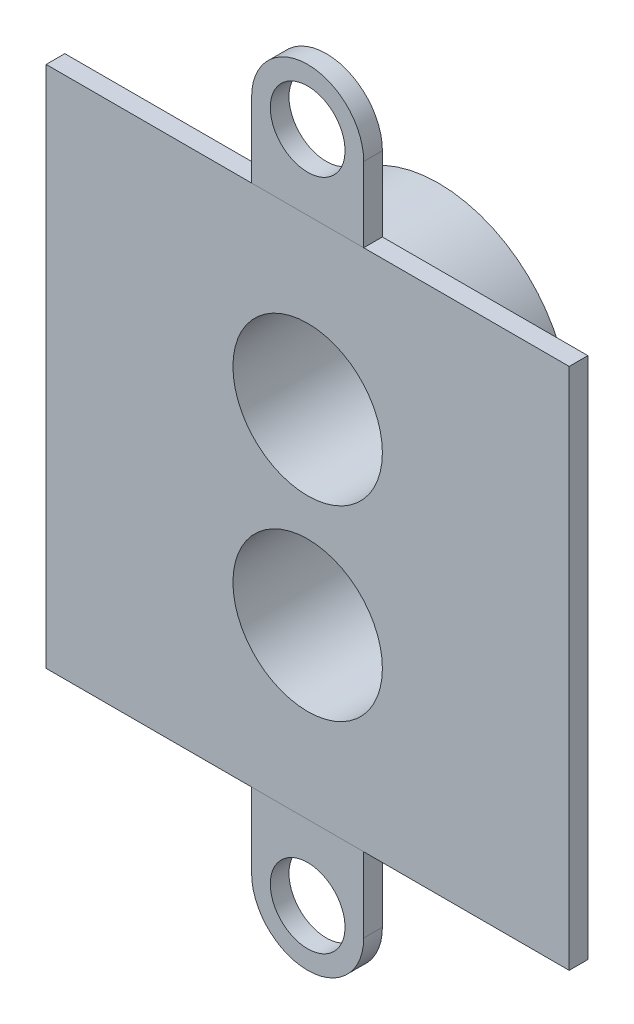
from build123d import *
from build123d.topology import SkipClean

# Parameters (mm, degrees)
SKETCH_2_W          = 14
SKETCH_2_H          = 14
SKETCH_2_R          = 2
EXTRUDE_1_DEPTH     = 0.5
SKETCH_3_W          = 3
SKETCH_3_H          = 0.5
EXTRUDE_2_DEPTH     = 3.5
CUT_EXTRUDE_1_DEPTH = 4
SKETCH_5_R          = 1
CUT_EXTRUDE_2_DEPTH = 4
EXTRUDE_START       = 3
SKETCH_8_R          = 2
EXTRUDE_4_DEPTH     = 3


with BuildPart() as part:
    # 草图2 → 凸台-拉伸1 (new body)
    with BuildSketch(Plane.XY):
        Rectangle(SKETCH_2_W, SKETCH_2_H)
        with Locations((0, -2.5)):
            Circle(SKETCH_2_R, mode=Mode.SUBTRACT)
        with Locations((0, 2.5)):
            Circle(SKETCH_2_R, mode=Mode.SUBTRACT)
    extrude(amount=EXTRUDE_1_DEPTH)

    # 草图8 → 凸台-拉伸4 (add)
    with SkipClean():  # the faces are left unmerged after this step: merging them gives an invalid solid
        with BuildSketch(Plane(origin=(0, 0, 0), x_dir=(-1, 0, 0), z_dir=(0, 0, -1)).offset(EXTRUDE_START)):
            with BuildLine():
                ThreePointArc((2.449489743, 0), (0, 6), (-2.449489743, 0))
                ThreePointArc((-2.449489743, 0), (0, -6), (2.449489743, 0))
            make_face()
            with Locations((0, -2.5)):
                Circle(SKETCH_8_R, mode=Mode.SUBTRACT)
            with Locations((0, 2.5)):
                Circle(SKETCH_8_R, mode=Mode.SUBTRACT)
        extrude(amount=-EXTRUDE_4_DEPTH)


with BuildPart() as body_2:
    # 草图3 → 凸台-拉伸2 (new body)
    with BuildSketch(Plane.XZ.offset(7)):
        with Locations((0, 0.25)):
            Rectangle(SKETCH_3_W, SKETCH_3_H)
    extrude(amount=EXTRUDE_2_DEPTH)

    # 草图4 → 切除-拉伸1 (cut)
    with BuildSketch(Plane(origin=(0, 0, 0), x_dir=(-1, 0, 0), z_dir=(0, 0, -1))):
        with BuildLine():
            Line((1.5, -10.5), (1.5, -9))
            ThreePointArc((1.5, -9), (1.060660172, -10.060660172), (0, -10.5))
            Line((0, -10.5), (1.5, -10.5))
        make_face()
        with BuildLine():
            ThreePointArc((0, -10.5), (-1.060660172, -10.060660172), (-1.5, -9))
            Line((-1.5, -9), (-1.5, -10.5))
            Line((-1.5, -10.5), (0, -10.5))
        make_face()
    extrude(amount=-CUT_EXTRUDE_1_DEPTH, mode=Mode.SUBTRACT)

    # 草图5 → 切除-拉伸2 (cut)
    with BuildSketch(Plane(origin=(0, 0, 0), x_dir=(-1, 0, 0), z_dir=(0, 0, -1))):
        with Locations((0, -9)):
            Circle(SKETCH_5_R)
    extrude(amount=-CUT_EXTRUDE_2_DEPTH, mode=Mode.SUBTRACT)


with BuildPart() as body_3:
    # 镜向7: mirrored copy
    add(body_2.part.mirror(Plane.ZX))


solid = Compound([part.part, body_2.part, body_3.part])
